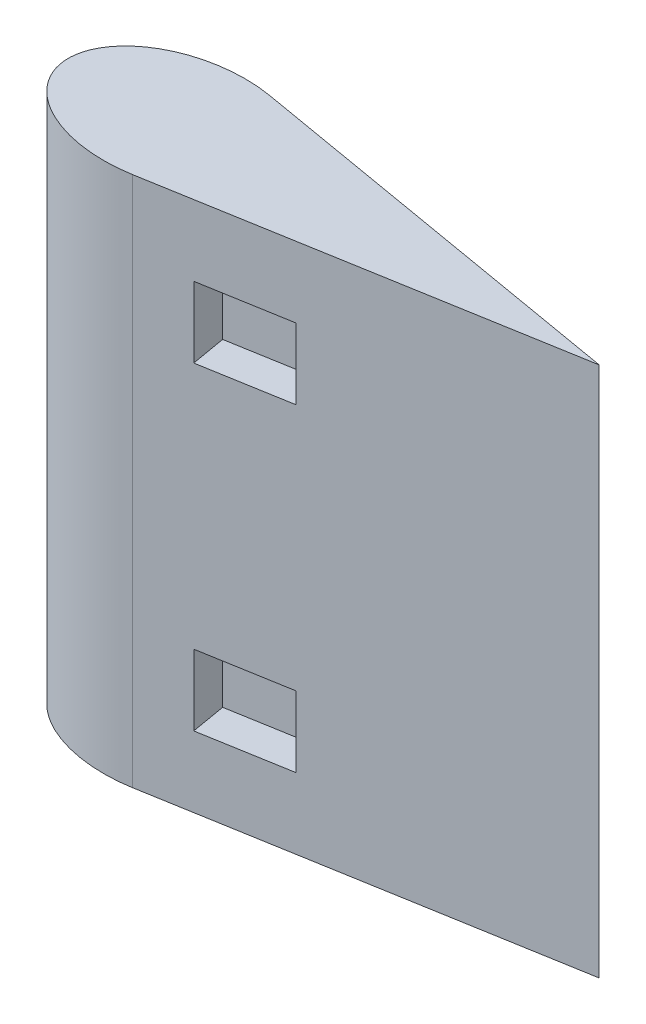
from build123d import *

# Parameters (mm, degrees)
BOSS_EXTRUDE2_DEPTH = 150
SKETCH12_W          = 25
SKETCH12_H          = 20
CUT_EXTRUDE1_DEPTH  = 10


with BuildPart() as part:
    # Sketch1 → Boss-Extrude2 (new body)
    with BuildSketch(Plane(origin=(0, 0, 0), x_dir=(1, 0, 0), z_dir=(0, 1, 0))):
        with BuildLine():
            Line((150, 0), (37.5, 19.364916731))
            add(Edge.make_bspline(
                [(37.5, 19.364916731), (0, 25.819888975), (0, 0), (0, -25.819888975), (37.5, -19.364916731)],
                knots=[4.459708725, 4.459708725, 4.459708725, 6.283185307, 6.283185307, 8.106661889, 8.106661889, 8.106661889], degree=2, weights=[1, 0.612372436, 1, 0.612372436, 1]))
            Line((37.5, -19.364916731), (150, 0))
        make_face()
    extrude(amount=BOSS_EXTRUDE2_DEPTH)

    # Sketch12 → Cut-Extrude1 (cut)
    with BuildSketch(Plane(origin=(4.316546763, 0, 25.076870587), x_dir=(0.9855064797264064, 0, -0.16963778593599424), z_dir=(0.16963778593599424, 0, 0.9855064797264064))):
        Polygon((48.671471391, 130), (73.671471391, 130), (73.671571391, 110), (48.671471391, 110), align=None)
        with Locations((61.171471391, 30)):
            Rectangle(SKETCH12_W, SKETCH12_H)
    extrude(amount=-CUT_EXTRUDE1_DEPTH, mode=Mode.SUBTRACT)


solid = part.part
